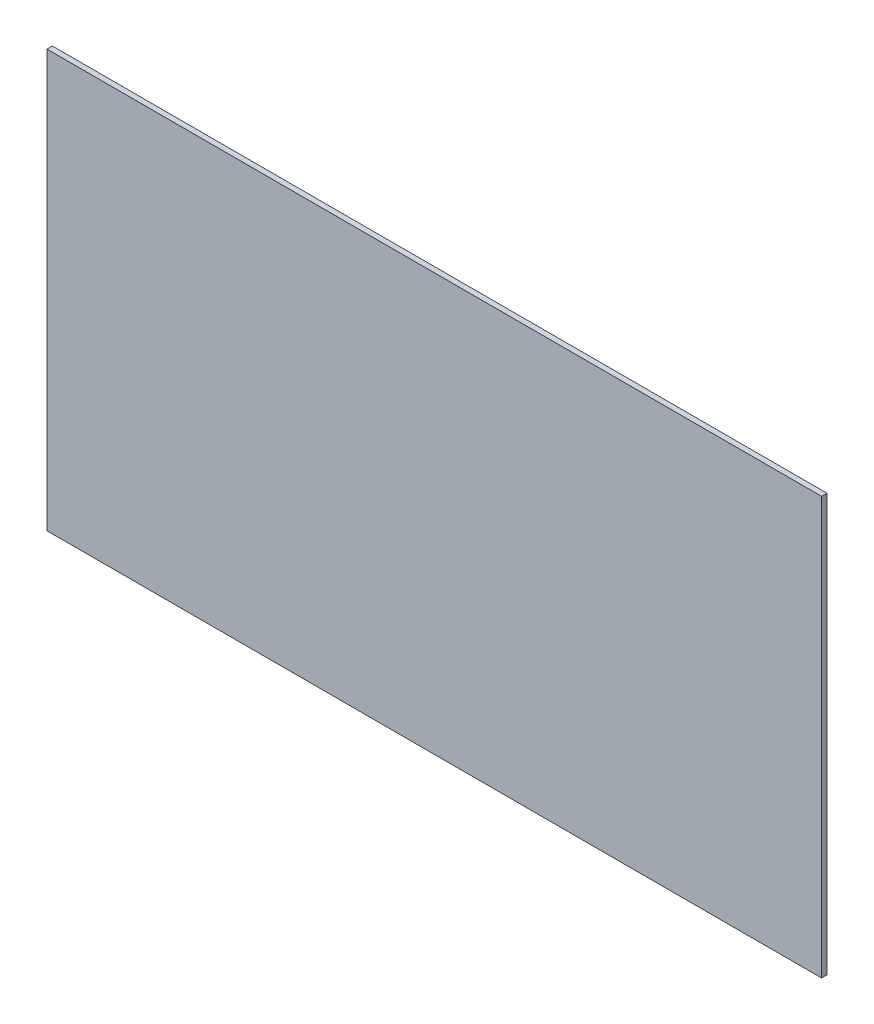
from build123d import *

# Parameters (mm, degrees)
SKETCH1_W           = 1816.1
SKETCH1_H           = 977.9
BOSS_EXTRUDE1_DEPTH = 12.7


with BuildPart() as part:
    # Sketch1 → Boss-Extrude1 (new body)
    with BuildSketch(Plane.XY):
        with Locations((908.05, 488.95)):
            Rectangle(SKETCH1_W, SKETCH1_H)
    extrude(amount=BOSS_EXTRUDE1_DEPTH)


solid = part.part
